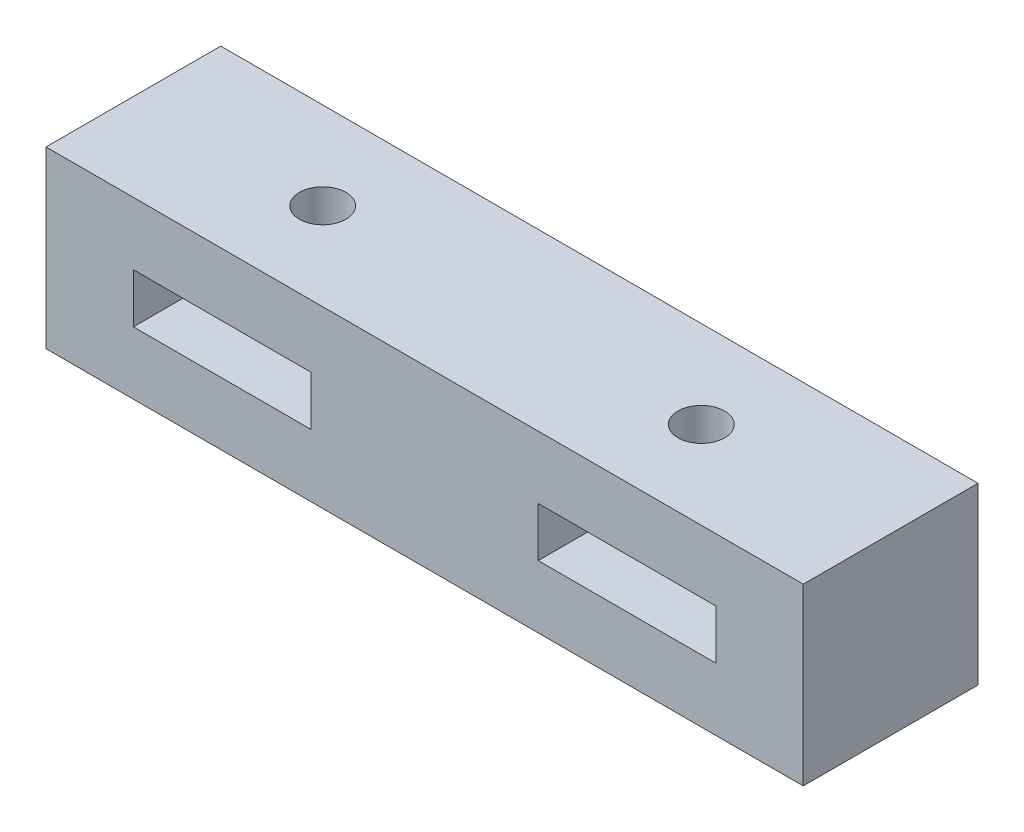
from build123d import *

# Parameters (mm, degrees)
CROQUIS1_W              = 52
CROQUIS1_H              = 12
CROQUIS1_W_2            = 12.2
CROQUIS1_H_2            = 3.4
SALIENTE_EXTRUIR1_DEPTH = 6
CROQUIS2_R              = 4.15
CORTAR_EXTRUIR1_DEPTH   = 9
CROQUIS3_R              = 1.6
CORTAR_EXTRUIR2_DEPTH   = 30


with BuildPart() as part:
    # Croquis1 → Saliente-Extruir1 (new, symmetric)
    with BuildSketch(Plane.XY):
        Rectangle(CROQUIS1_W, CROQUIS1_H)
        with Locations((13.9, 0)):
            Rectangle(CROQUIS1_W_2, CROQUIS1_H_2, mode=Mode.SUBTRACT)
        with Locations((-13.9, 0)):
            Rectangle(CROQUIS1_W_2, CROQUIS1_H_2, mode=Mode.SUBTRACT)
    extrude(amount=SALIENTE_EXTRUIR1_DEPTH, both=True)

    # Croquis2 → Cortar-Extruir1 (cut)
    with BuildSketch(Plane(origin=(0, 0, -6), x_dir=(-1, 0, 0), z_dir=(0, 0, -1))):
        Circle(CROQUIS2_R)
    extrude(amount=-CORTAR_EXTRUIR1_DEPTH, mode=Mode.SUBTRACT)

    # Croquis3 → Cortar-Extruir2 (cut)
    with BuildSketch(Plane(origin=(0, 6, 0), x_dir=(1, 0, 0), z_dir=(0, 1, 0))):
        with Locations(Location((-13, 0, 0), (0, 0, 180))):
            Circle(CROQUIS3_R)
        with Locations(Location((13, 0, 0), (0, 0, 180))):
            Circle(CROQUIS3_R)
    extrude(amount=-CORTAR_EXTRUIR2_DEPTH, mode=Mode.SUBTRACT)


solid = part.part
